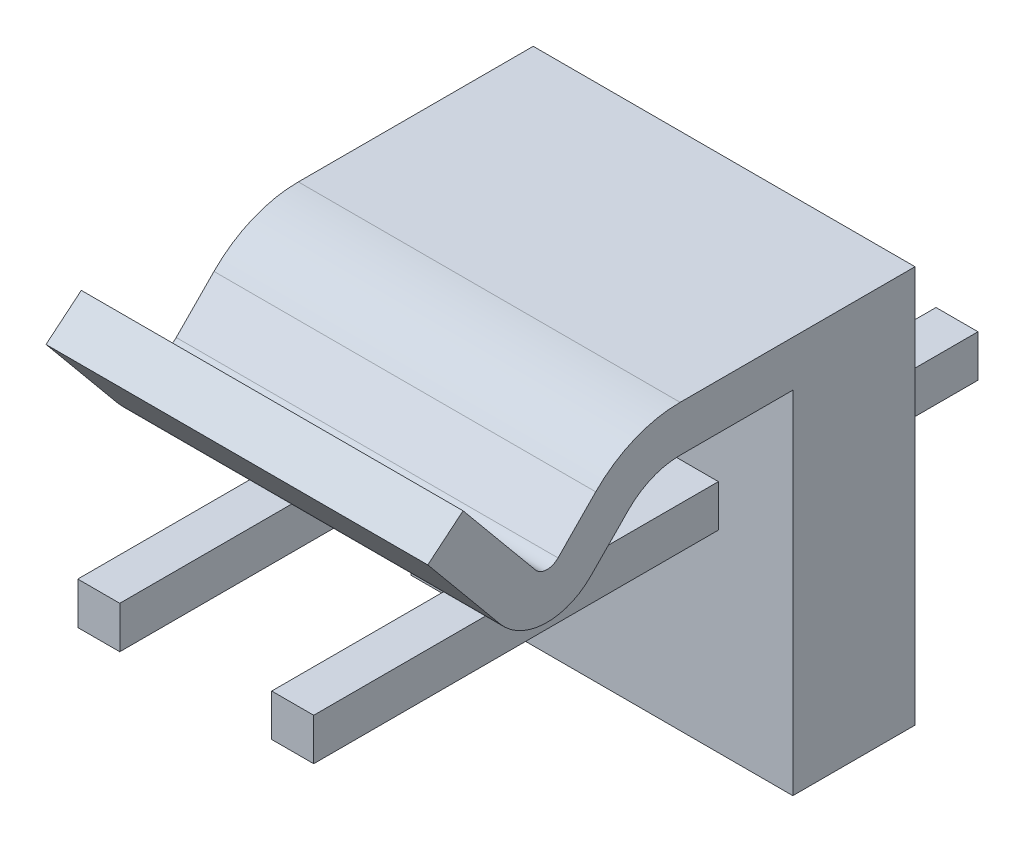
from build123d import *

# Parameters (mm, degrees)
SKETCH_2_W           = 15
SKETCH_2_H           = 10.4
EXTRUDE_1_DEPTH      = 3.2
EXTRUDE_2_DEPTH      = 13.8
EXTRUDE_2_DEPTH_BACK = 3.6
SKETCH_3_W           = 1.1
SKETCH_3_H           = 1.1
SKETCH_5_W           = 15
SKETCH_5_H           = 1.2
SKETCH_6_W           = 19.881870093
SKETCH_6_H           = 13.435857504
CUT_EXTRUDE_1_DEPTH  = 5
SKETCH_7_R           = 0.25
CUT_EXTRUDE_2_DEPTH  = 1


with BuildPart() as part:
    # Эскиз2 → Вытянуть1 (new body)
    with BuildSketch(Plane.XY):
        with Locations((5.08, -0.4)):
            Rectangle(SKETCH_2_W, SKETCH_2_H)
    extrude(amount=EXTRUDE_1_DEPTH)

    # Эскиз3 → Вытянуть2 (add, two sides: drawn at the far end of the back side and taken through both)
    with BuildSketch(Plane.XY.offset(-EXTRUDE_2_DEPTH_BACK)):
        Rectangle(SKETCH_3_W, SKETCH_3_H)
        with Locations((5.08, 0)):
            Rectangle(SKETCH_3_W, SKETCH_3_H)
        with Locations((10.16, 0)):
            Rectangle(SKETCH_3_W, SKETCH_3_H)
    extrude(amount=EXTRUDE_2_DEPTH + EXTRUDE_2_DEPTH_BACK)

    # По траектории1: sweep along a path in Эскиз4
    with BuildLine(Plane.ZY.offset(2.42)) as sweep_1_path:
        Line((3.2, 4.2), (6.152565934, 4.2))
        ThreePointArc((6.152565934, 4.2), (7.118635036, 4.005799317), (7.934615114, 3.453368392))
        Line((7.934615114, 3.453368392), (8.923160693, 2.448652643))
        ThreePointArc((8.923160693, 2.448652643), (9.678881269, 2.150920668), (10.406297634, 2.512339193))
        Line((10.406297634, 2.512339193), (12.3, 4.8))
    # Эскиз5 → По траектории1 (sweep)
    with BuildSketch(Plane.XY.offset(3.2)):
        with Locations((5.08, 4.2)):
            Rectangle(SKETCH_5_W, SKETCH_5_H)
    sweep(path=sweep_1_path.line)

    # Эскиз6 → Вырез-Вытянуть1 (cut)
    with BuildSketch(Plane(origin=(12.58, 0, 0), x_dir=(0, 0, -1), z_dir=(1, 0, 0))):
        with Locations((-5.619839725, -0.208714258)):
            Rectangle(SKETCH_6_W, SKETCH_6_H)
    extrude(amount=-CUT_EXTRUDE_1_DEPTH, mode=Mode.SUBTRACT)

    # Эскиз7 → Вырез-Вытянуть2 (cut)
    with BuildSketch(Plane(origin=(0, 0, -3.6), x_dir=(-1, 0, 0), z_dir=(0, 0, -1))):
        Circle(SKETCH_7_R)
    extrude(amount=-CUT_EXTRUDE_2_DEPTH, mode=Mode.SUBTRACT)


solid = part.part
